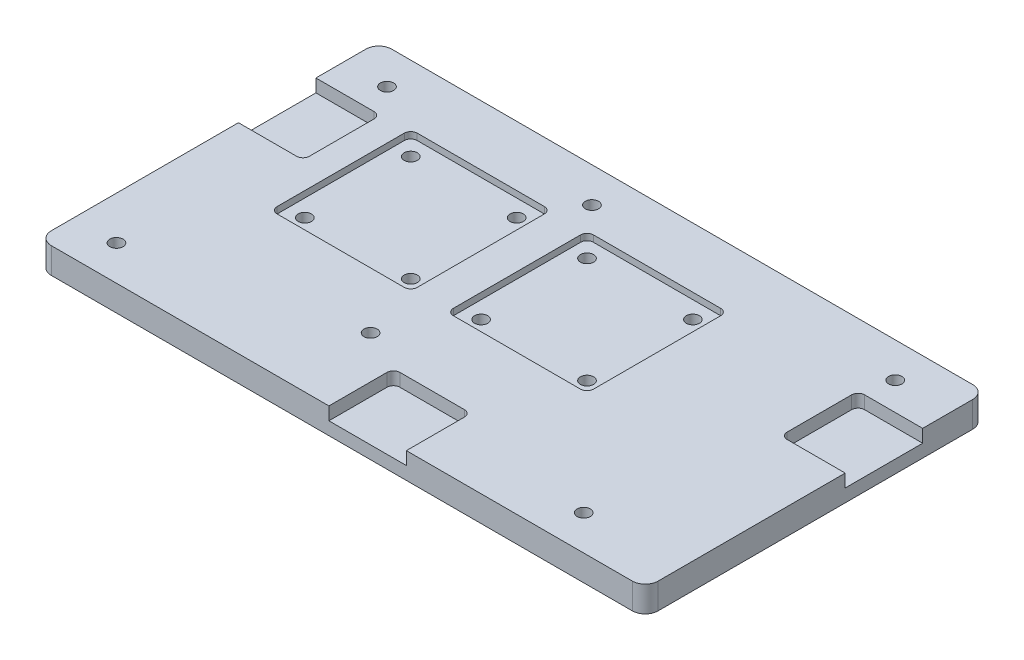
from build123d import *

# Parameters (mm, degrees)
SKETCH_2_W          = 94.005
SKETCH_2_H          = 52.73
EXTRUDE_1_DEPTH     = 4
FILLET_1_R          = 2
M2_5X0_45_1_D       = 2.05
CUT_EXTRUDE_1_DEPTH = 1
SKETCH_8_W          = 10
SKETCH_8_H          = 12
SKETCH_8_W_2        = 12
SKETCH_8_H_2        = 10
CUT_EXTRUDE_2_DEPTH = 2
FILLET_2_R          = 1


with BuildPart() as part:
    # 草图2 → 凸台-拉伸1 (new body)
    with BuildSketch(Plane(origin=(0, 0, 0), x_dir=(1, 0, 0), z_dir=(0, 1, 0))):
        with Locations((150.1775, -79.375)):
            Rectangle(SKETCH_2_W, SKETCH_2_H)
    extrude(amount=-EXTRUDE_1_DEPTH)

    # 圆角1
    fillet_1_edges = [part.edges().sort_by_distance(p)[0] for p in [
        (103.175, -2, 53.01),
        (197.18, -2, 105.74),
        (197.18, -2, 53.01),
        (103.175, -2, 105.74),
    ]]
    fillet(fillet_1_edges, radius=FILLET_1_R)

    # M2.5x0.45 螺纹孔1 (through all)
    with Locations(Plane(origin=(109.855, 0, 58.42), x_dir=(0, 0, 1), z_dir=(0, 1, 0))):
        with Locations((0, 0), (41.91, 0), (34.29, 31.75), (22.932, 26.615), (22.932, 10.215), (6.532, 10.215), (6.532, 26.615), (6.532, 37.52), (22.932, 37.52), (22.932, 53.92), (6.532, 53.92), (0, 78.74), (41.91, 72.39), (0, 31.75)):
            Hole(M2_5X0_45_1_D / 2)

    # 草图7 → 切除-拉伸1 (cut)
    with BuildSketch(Plane(origin=(0, 0, 0), x_dir=(1, 0, 0), z_dir=(0, 1, 0))):
        with BuildLine():
            Line((118.42, -62.302), (138.12, -62.302))
            ThreePointArc((138.12, -62.302), (138.827106781, -62.594893219), (139.12, -63.302))
            Line((139.12, -63.302), (139.12, -83.002))
            ThreePointArc((139.12, -83.002), (138.827106781, -83.709106781), (138.12, -84.002))
            Line((138.12, -84.002), (118.42, -84.002))
            ThreePointArc((118.42, -84.002), (117.712893219, -83.709106781), (117.42, -83.002))
            Line((117.42, -83.002), (117.42, -63.302))
            ThreePointArc((117.42, -63.302), (117.712893219, -62.594893219), (118.42, -62.302))
        make_face()
        with BuildLine():
            Line((145.725, -62.302), (165.425, -62.302))
            ThreePointArc((165.425, -62.302), (166.132106781, -62.594893219), (166.425, -63.302))
            Line((166.425, -63.302), (166.425, -83.002))
            ThreePointArc((166.425, -83.002), (166.132106781, -83.709106781), (165.425, -84.002))
            Line((165.425, -84.002), (145.725, -84.002))
            ThreePointArc((145.725, -84.002), (145.017893219, -83.709106781), (144.725, -83.002))
            Line((144.725, -83.002), (144.725, -63.302))
            ThreePointArc((144.725, -63.302), (145.017893219, -62.594893219), (145.725, -62.302))
        make_face()
    extrude(amount=-CUT_EXTRUDE_1_DEPTH, mode=Mode.SUBTRACT)

    # 草图8 → 切除-拉伸2 (cut)
    with BuildSketch(Plane(origin=(0, 0, 0), x_dir=(1, 0, 0), z_dir=(0, 1, 0))):
        with Locations((108.175, -68.752)):
            Rectangle(SKETCH_8_W, SKETCH_8_H)
        with Locations((192.18, -68.758)):
            Rectangle(SKETCH_8_W, SKETCH_8_H)
        with Locations((154.178, -100.74)):
            Rectangle(SKETCH_8_W_2, SKETCH_8_H_2)
    extrude(amount=-CUT_EXTRUDE_2_DEPTH, mode=Mode.SUBTRACT)

    # 圆角2
    fillet_2_edges = [part.edges().sort_by_distance(p)[0] for p in [
        (187.18, -1, 74.758),
        (187.18, -1, 62.758),
        (160.178, -1, 95.74),
        (148.178, -1, 95.74),
        (113.175, -1, 74.752),
        (113.175, -1, 62.752),
    ]]
    fillet(fillet_2_edges, radius=FILLET_2_R)


solid = part.part
